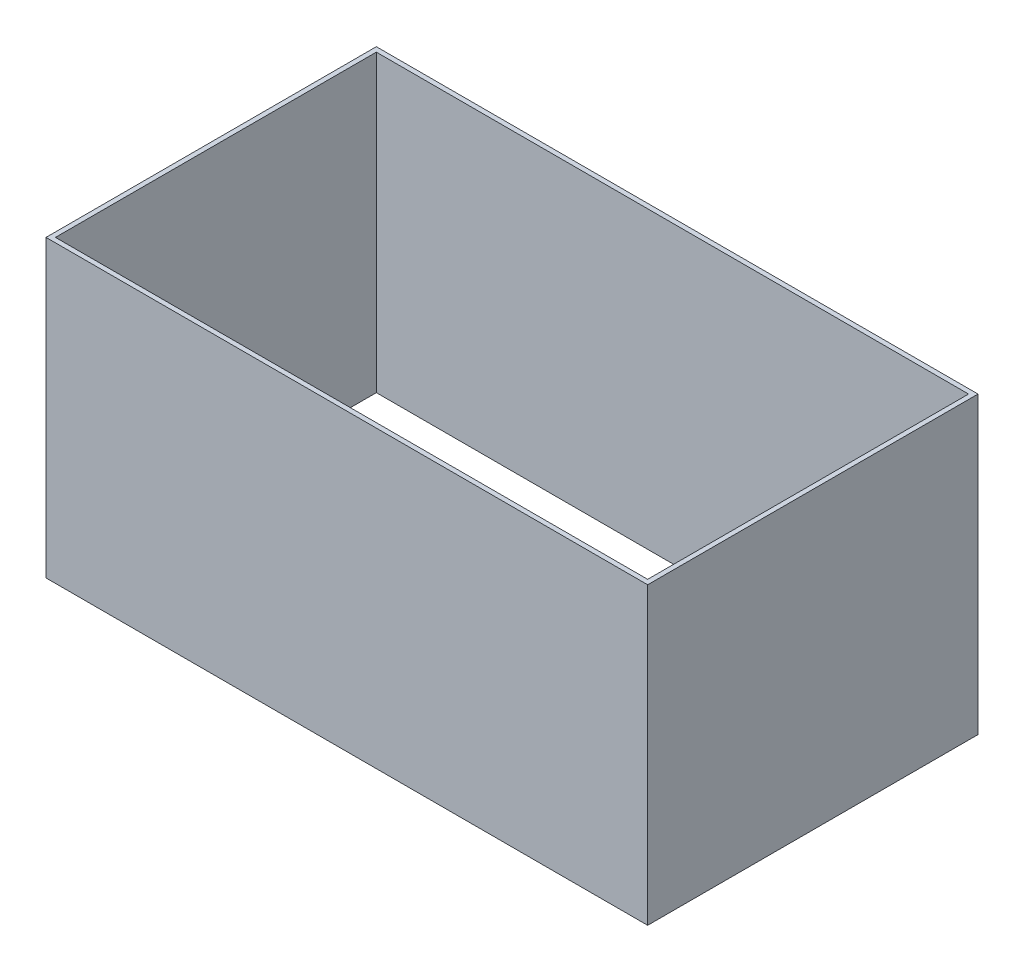
from build123d import *

# Parameters (mm, degrees)
SKETCH1_W      = 102
SKETCH1_H      = 56
SKETCH1_W_2    = 100.4
SKETCH1_H_2    = 54.4
WALLS_DEPTH    = 50
USB_HOLE_REACH = 118.996
SKETCH3_W      = 8
SKETCH3_H      = 6


with BuildPart() as part:
    # Sketch1 → WALLS (new body)
    with BuildSketch(Plane(origin=(0, 0, 0), x_dir=(1, 0, 0), z_dir=(0, 1, 0))):
        Rectangle(SKETCH1_W, SKETCH1_H)
        Rectangle(SKETCH1_W_2, SKETCH1_H_2, mode=Mode.SUBTRACT)
    extrude(amount=WALLS_DEPTH)

    # Sketch3 → USB_HOLE (cut, up to next)
    with BuildSketch(Plane.ZY.offset(51), mode=Mode.PRIVATE) as usb_hole_sk1:
        with Locations((-11, 3)):
            Rectangle(SKETCH3_W, SKETCH3_H)
    usb_hole_tool1 = extrude(usb_hole_sk1.sketch, amount=-USB_HOLE_REACH, mode=Mode.PRIVATE) & part.part
    add(usb_hole_tool1.solids().sort_by_distance((-51, 3, -11))[0], mode=Mode.SUBTRACT)


solid = part.part
